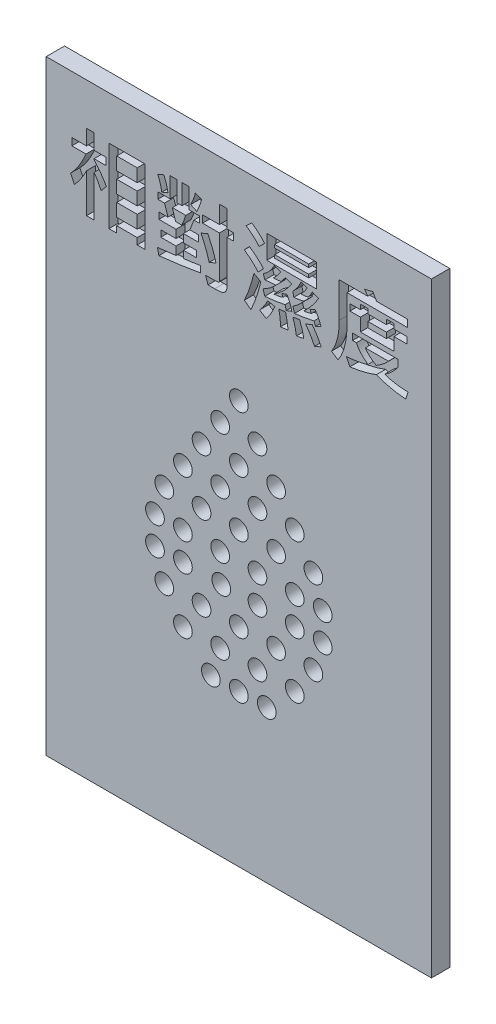
from build123d import *

# Parameters (mm, degrees)
SKETCH_4_W          = 105
SKETCH_4_H          = 165
EXTRUDE_2_DEPTH     = 5
SKETCH_11_R         = 2.55
CUT_EXTRUDE_6_DEPTH = 196.639975465
SKETCH_12_W         = 5.594131098
SKETCH_12_H         = 3.512195121
SKETCH_12_H_2       = 3.512195122
SKETCH_12_W_2       = 13.565167683
SKETCH_12_H_3       = 6.365853659
SKETCH_12_W_3       = 9.260670731
SKETCH_12_H_4       = 0.878048781
SKETCH_12_W_4       = 5.048780487
SKETCH_12_H_5       = 1.536585366
CUT_EXTRUDE_7_DEPTH = 2.5


with BuildPart() as part:
    # 草圖4 → 填料-伸長2 (new body)
    with BuildSketch(Plane.XY):
        with Locations((52.5, 82.5)):
            Rectangle(SKETCH_4_W, SKETCH_4_H)
    extrude(amount=EXTRUDE_2_DEPTH)

    # 草圖11 → 除料-伸長6 (cut, through all)
    with BuildSketch(Plane.XY.offset(5)):
        with Locations((52.5, 110)):
            Circle(SKETCH_11_R)
        with Locations((29.64, 71.9)):
            Circle(SKETCH_11_R)
        with Locations((29.64, 64.28)):
            Circle(SKETCH_11_R)
        with Locations((57.58, 64.28)):
            Circle(SKETCH_11_R)
        with Locations((75.36, 64.28)):
            Circle(SKETCH_11_R)
        with Locations((67.74, 64.28)):
            Circle(SKETCH_11_R)
        with Locations((62.66, 56.66)):
            Circle(SKETCH_11_R)
        with Locations((52.5, 56.66)):
            Circle(SKETCH_11_R)
        with Locations((32.18, 56.66)):
            Circle(SKETCH_11_R)
        with Locations((37.26, 49.04)):
            Circle(SKETCH_11_R)
        with Locations((52.5, 41.42)):
            Circle(SKETCH_11_R)
        with Locations((60.12, 41.42)):
            Circle(SKETCH_11_R)
        with Locations((42.34, 94.76)):
            Circle(SKETCH_11_R)
        with Locations((47.42, 102.38)):
            Circle(SKETCH_11_R)
        with Locations((57.58, 102.38)):
            Circle(SKETCH_11_R)
        with Locations((52.5, 94.76)):
            Circle(SKETCH_11_R)
        with Locations((62.66, 94.76)):
            Circle(SKETCH_11_R)
        with Locations((57.58, 87.14)):
            Circle(SKETCH_11_R)
        with Locations((67.74, 87.14)):
            Circle(SKETCH_11_R)
        with Locations((47.42, 87.14)):
            Circle(SKETCH_11_R)
        with Locations((37.26, 87.14)):
            Circle(SKETCH_11_R)
        with Locations((32.18, 79.52)):
            Circle(SKETCH_11_R)
        with Locations((42.34, 79.52)):
            Circle(SKETCH_11_R)
        with Locations((52.5, 79.52)):
            Circle(SKETCH_11_R)
        with Locations((62.66, 79.52)):
            Circle(SKETCH_11_R)
        with Locations((72.82, 79.52)):
            Circle(SKETCH_11_R)
        with Locations((75.36, 71.9)):
            Circle(SKETCH_11_R)
        with Locations((67.74, 71.9)):
            Circle(SKETCH_11_R)
        with Locations((57.58, 71.9)):
            Circle(SKETCH_11_R)
        with Locations((47.42, 71.9)):
            Circle(SKETCH_11_R)
        with Locations((37.26, 71.9)):
            Circle(SKETCH_11_R)
        with Locations((37.26, 64.28)):
            Circle(SKETCH_11_R)
        with Locations((47.72, 64.28)):
            Circle(SKETCH_11_R)
        with Locations((72.82, 56.66)):
            Circle(SKETCH_11_R)
        with Locations((42.34, 56.66)):
            Circle(SKETCH_11_R)
        with Locations((44.88, 41.42)):
            Circle(SKETCH_11_R)
        with Locations((47.42, 49.04)):
            Circle(SKETCH_11_R)
        with Locations((57.58, 49.04)):
            Circle(SKETCH_11_R)
        with Locations((67.74, 49.04)):
            Circle(SKETCH_11_R)
    extrude(amount=-CUT_EXTRUDE_6_DEPTH, mode=Mode.SUBTRACT)

    # 草圖12 → 除料-伸長7 (cut)
    # profile 1 of 20: a face of its own
    with BuildSketch(Plane.XY.offset(5)):
        with BuildLine():
            Line((16.410788695, 142.535623884), (14.963380159, 140.834404372))
            add(Edge.make_bspline(
                [(14.963380159, 140.834404372), (14.806352489, 141.161795807), (14.504596602, 141.790935206), (14.020781763, 142.67375544), (13.547360747, 143.469657872), (13.205702316, 143.951845162), (13.042648451, 144.181965347)],
                knots=[0, 0, 0, 0, 1.127094562, 2.16590759, 3.124693467, 4, 4, 4, 4], degree=3))
            Line((13.042648451, 144.181965347), (13.042648451, 132.931965347))
            Line((13.042648451, 132.931965347), (10.981291744, 132.931965347))
            Line((10.981291744, 132.931965347), (10.981291744, 143.537148274))
            add(Edge.make_bspline(
                [(10.981291744, 143.537148274), (10.876853719, 143.32010418), (10.667476337, 142.884974116), (10.318520089, 142.24832537), (9.948990335, 141.61890624), (9.55005242, 141.002309749), (9.128065376, 140.394790299), (8.681640689, 139.796972266), (8.208817935, 139.209282907), (7.874160368, 138.830093388), (7.705758207, 138.639282421)],
                knots=[0, 0, 0, 0, 0.977466001, 1.959624121, 2.945677103, 3.93937651, 4.939577317, 5.947477452, 6.967155486, 8, 8, 8, 8], degree=3))
            Line((7.705758207, 138.639282421), (6.663075281, 140.834404372))
            add(Edge.make_bspline(
                [(6.663075281, 140.834404372), (6.85761897, 141.036811539), (7.254688789, 141.449930963), (7.815144547, 142.125091692), (8.362617873, 142.85871992), (8.891794512, 143.652649208), (9.404112133, 144.50911243), (9.903369599, 145.423058038), (10.388174989, 146.397568034), (10.687796233, 147.074427862), (10.840666744, 147.419770225)],
                knots=[0, 0, 0, 0, 0.858778597, 1.752794251, 2.682626736, 3.658683669, 4.670785783, 5.735335257, 6.84453968, 8, 8, 8, 8], degree=3))
            Line((10.840666744, 147.419770225), (6.975194183, 147.419770225))
            Line((6.975194183, 147.419770225), (6.975194183, 149.395379982))
            Line((6.975194183, 149.395379982), (10.981291744, 149.395379982))
            Line((10.981291744, 149.395379982), (10.981291744, 153.566111689))
            Line((10.981291744, 153.566111689), (13.042648451, 153.566111689))
            Line((13.042648451, 153.566111689), (13.042648451, 149.395379982))
            Line((13.042648451, 149.395379982), (16.338761256, 149.395379982))
            Line((16.338761256, 149.395379982), (16.338761256, 147.419770225))
            Line((16.338761256, 147.419770225), (13.042648451, 147.419770225))
            Line((13.042648451, 147.419770225), (13.042648451, 147.255136079))
            add(Edge.make_bspline(
                [(13.042648451, 147.255136079), (13.221651043, 147.038443988), (13.572706075, 146.613473334), (14.077468292, 145.980070474), (14.545493628, 145.361429872), (14.988775701, 144.766822926), (15.386568139, 144.180947392), (15.762986865, 143.620386838), (16.10372503, 143.075277404), (16.310212303, 142.712383333), (16.410788695, 142.535623884)],
                knots=[0, 0, 0, 0, 1.161799404, 2.278489499, 3.347511781, 4.368347036, 5.343633091, 6.274248836, 7.159416347, 8, 8, 8, 8], degree=3))
        make_face()
    # profile 2 of 20: a face of its own
    with BuildSketch(Plane.XY.offset(5)):
        Polygon((26.885636256, 132.931965347), (24.803700281, 132.931965347), (24.803700281, 134.688062908), (19.209569183, 134.688062908), (19.209569183, 132.931965347), (17.093334427, 132.931965347), (17.093334427, 153.127087299), (26.885636256, 153.127087299), align=None)
        with Locations((22.006634732, 149.395379982)):
            Rectangle(SKETCH_12_W, SKETCH_12_H, mode=Mode.SUBTRACT)
        with Locations((22.006634732, 143.907575103)):
            Rectangle(SKETCH_12_W, SKETCH_12_H_2, mode=Mode.SUBTRACT)
        with Locations((22.006634732, 138.419770225)):
            Rectangle(SKETCH_12_W, SKETCH_12_H_2, mode=Mode.SUBTRACT)
    # profile 3 of 20: a face of its own
    with BuildSketch(Plane.XY.offset(5)):
        with BuildLine():
            Line((51.021688085, 146.980745835), (49.262160646, 146.980745835))
            Line((49.262160646, 146.980745835), (49.262160646, 135.264282421))
            add(Edge.make_bspline(
                [(49.262160646, 135.264282421), (49.258912173, 135.127714892), (49.252761117, 134.869121284), (49.17076933, 134.50698461), (49.046679573, 134.189279105), (48.861080184, 133.92694558), (48.6413622, 133.716864182), (48.409438362, 133.535439233), (48.154289326, 133.400089153), (47.926002637, 133.314236595), (47.723484815, 133.263890618), (47.543343589, 133.234308814), (47.336914081, 133.212712969), (47.105239097, 133.186128328), (46.846556236, 133.170428195), (46.560617571, 133.160995655), (46.24847217, 133.153949287), (46.031219368, 133.152324214), (45.918029549, 133.151477542)],
                knots=[0, 0, 0, 0, 1.432178217, 2.711860847, 3.880961985, 4.994154237, 6.05611614, 7.0677495, 8.078383575, 9.078176166, 9.623076621, 10.268952323, 10.994702176, 11.804044535, 12.719108509, 13.716950142, 14.81051937, 16, 16, 16, 16], degree=3))
            add(Edge.make_bspline(
                [(45.918029549, 133.151477542), (45.629919793, 133.151477542), (45.023974671, 133.151477542), (44.418029549, 133.151477542), (44.100194183, 133.151477542)],
                knots=[0, 0, 0, 0, 0.950943396, 2, 2, 2, 2], degree=3))
            Line((44.100194183, 133.151477542), (43.417648451, 135.127087299))
            add(Edge.make_bspline(
                [(43.417648451, 135.127087299), (43.743486866, 135.127087299), (44.37572772, 135.127087299), (45.007968573, 135.127087299), (45.314371012, 135.127087299)],
                knots=[0, 0, 0, 0, 1.03074141, 2, 2, 2, 2], degree=3))
            add(Edge.make_bspline(
                [(45.314371012, 135.127087299), (45.430997824, 135.126302619), (45.651699172, 135.124817712), (45.962592154, 135.134606186), (46.233797357, 135.137829949), (46.463438304, 135.153826385), (46.653447525, 135.165924473), (46.803608765, 135.182124656), (46.915085089, 135.201375881), (47.011120257, 135.229807358), (47.090547795, 135.290429098), (47.155984683, 135.381318494), (47.193752461, 135.495935613), (47.198341065, 135.579543927), (47.200803939, 135.624419616)],
                knots=[0, 0, 0, 0, 1.944896568, 3.680468406, 5.187292513, 6.467097316, 7.518585867, 8.362960417, 8.983756933, 9.405836548, 10.019861071, 10.607254988, 11.252462004, 12, 12, 12, 12], degree=3))
            Line((47.200803939, 135.624419616), (47.200803939, 146.980745835))
            Line((47.200803939, 146.980745835), (42.604767354, 146.980745835))
            Line((42.604767354, 146.980745835), (42.604767354, 148.956355591))
            Line((42.604767354, 148.956355591), (47.200803939, 148.956355591))
            Line((47.200803939, 148.956355591), (47.200803939, 153.785623884))
            Line((47.200803939, 153.785623884), (49.262160646, 153.785623884))
            Line((49.262160646, 153.785623884), (49.262160646, 148.956355591))
            Line((49.262160646, 148.956355591), (51.021688085, 148.956355591))
            Line((51.021688085, 148.956355591), (51.021688085, 146.980745835))
        make_face()
    # profile 4 of 20: a face of its own
    with BuildSketch(Plane.XY.offset(5)):
        with BuildLine():
            add(Edge.make_bspline(
                [(42.08342589, 134.962453152), (41.647973252, 134.885034428), (40.766352067, 134.728291809), (39.426448786, 134.505801969), (38.053345044, 134.292638552), (36.647769397, 134.091969994), (35.209799414, 133.89506832), (33.738249086, 133.710277209), (32.23341305, 133.536008388), (31.218788267, 133.426352996), (30.706520402, 133.370989738)],
                knots=[0, 0, 0, 0, 0.923789585, 1.8703124, 2.83691948, 3.826085748, 4.835874672, 5.868411536, 6.923794993, 8, 8, 8, 8], degree=3))
            Line((30.706520402, 133.370989738), (30.322374061, 135.127087299))
            add(Edge.make_bspline(
                [(30.322374061, 135.127087299), (30.653989168, 135.164299168), (31.283100267, 135.234894264), (32.174402147, 135.342927811), (32.962085794, 135.435913118), (33.646348381, 135.512282804), (34.224335516, 135.5863452), (34.699057725, 135.643703646), (35.069600748, 135.690989563), (35.282003918, 135.721408265), (35.371154549, 135.734175713)],
                knots=[0, 0, 0, 0, 1.574879537, 2.987723342, 4.237278493, 5.318190049, 6.237092805, 6.987341425, 7.574963259, 8, 8, 8, 8], degree=3))
            Line((35.371154549, 135.734175713), (35.371154549, 137.980745835))
            Line((35.371154549, 137.980745835), (31.227861866, 137.980745835))
            Line((31.227861866, 137.980745835), (31.227861866, 139.736843396))
            Line((31.227861866, 139.736843396), (35.371154549, 139.736843396))
            Line((35.371154549, 139.736843396), (35.371154549, 141.931965347))
            Line((35.371154549, 141.931965347), (30.706520402, 141.931965347))
            Line((30.706520402, 141.931965347), (30.706520402, 143.688062908))
            Line((30.706520402, 143.688062908), (33.17260272, 143.688062908))
            add(Edge.make_bspline(
                [(33.17260272, 143.688062908), (33.113554224, 143.905740214), (32.990788502, 144.358305711), (32.769451007, 145.050628688), (32.515847806, 145.785845465), (32.32255072, 146.283963473), (32.2225265, 146.541721445)],
                knots=[0, 0, 0, 0, 0.899262793, 1.869626752, 2.897609239, 4, 4, 4, 4], degree=3))
            Line((32.2225265, 146.541721445), (30.438989915, 146.541721445))
            Line((30.438989915, 146.541721445), (30.438989915, 148.297819006))
            Line((30.438989915, 148.297819006), (33.762541744, 148.297819006))
            Line((33.762541744, 148.297819006), (33.762541744, 153.785623884))
            Line((33.762541744, 153.785623884), (35.659264305, 153.785623884))
            Line((35.659264305, 153.785623884), (35.659264305, 148.297819006))
            Line((35.659264305, 148.297819006), (37.014066134, 148.297819006))
            Line((37.014066134, 148.297819006), (37.014066134, 153.785623884))
            Line((37.014066134, 153.785623884), (38.900499061, 153.785623884))
            Line((38.900499061, 153.785623884), (38.900499061, 148.297819006))
            Line((38.900499061, 148.297819006), (41.795316134, 148.297819006))
            Line((41.795316134, 148.297819006), (41.795316134, 146.541721445))
            Line((41.795316134, 146.541721445), (40.25530089, 146.541721445))
            add(Edge.make_bspline(
                [(40.25530089, 146.541721445), (40.188029239, 146.337750796), (40.045517464, 145.905648732), (39.790337889, 145.228014406), (39.497471657, 144.479821541), (39.281080109, 143.959760894), (39.168029549, 143.688062908)],
                knots=[0, 0, 0, 0, 0.843659117, 1.787251491, 2.843982302, 4, 4, 4, 4], degree=3))
            Line((39.168029549, 143.688062908), (41.565514305, 143.688062908))
            Line((41.565514305, 143.688062908), (41.565514305, 141.931965347))
            Line((41.565514305, 141.931965347), (37.384492963, 141.931965347))
            Line((37.384492963, 141.931965347), (37.384492963, 139.736843396))
            Line((37.384492963, 139.736843396), (41.020163695, 139.736843396))
            Line((41.020163695, 139.736843396), (41.020163695, 137.980745835))
            Line((41.020163695, 137.980745835), (37.384492963, 137.980745835))
            Line((37.384492963, 137.980745835), (37.384492963, 136.042864738))
            add(Edge.make_bspline(
                [(37.384492963, 136.042864738), (37.733359819, 136.081529122), (38.458294129, 136.161872492), (39.582387892, 136.31403012), (40.785282916, 136.499629046), (41.611489542, 136.643918364), (42.038837476, 136.718550713)],
                knots=[0, 0, 0, 0, 0.89536347, 1.860537016, 2.893382048, 4, 4, 4, 4], degree=3))
            Line((42.038837476, 136.718550713), (42.08342589, 134.962453152))
        make_face()
        with BuildLine():
            Line((38.032739915, 146.541721445), (34.376489915, 146.541721445))
            add(Edge.make_bspline(
                [(34.376489915, 146.541721445), (34.426742957, 146.383930439), (34.523627414, 146.079720079), (34.664688711, 145.639692526), (34.79520857, 145.233099134), (34.911777145, 144.859216928), (35.015061002, 144.519759202), (35.104189303, 144.212997167), (35.182731606, 143.939650551), (35.231694915, 143.768099754), (35.254538695, 143.688062908)],
                knots=[0, 0, 0, 0, 1.331052196, 2.566178376, 3.714131703, 4.763387016, 5.714001717, 6.566053143, 7.33099359, 8, 8, 8, 8], degree=3))
            Line((35.254538695, 143.688062908), (36.935178939, 143.688062908))
            add(Edge.make_bspline(
                [(36.935178939, 143.688062908), (37.054390289, 143.954963629), (37.282355434, 144.465351791), (37.58657725, 145.207558765), (37.835208345, 145.891873494), (37.969317897, 146.333072932), (38.032739915, 146.541721445)],
                knots=[0, 0, 0, 0, 1.146244092, 2.191936434, 3.144945024, 4, 4, 4, 4], degree=3))
        make_face(mode=Mode.SUBTRACT)
    # profile 5 of 20: a face of its own
    with BuildSketch(Plane.XY.offset(5)):
        with BuildLine():
            add(Edge.make_bspline(
                [(42.340666744, 152.489129982), (42.313432661, 152.360753657), (42.257412204, 152.096683797), (42.144688234, 151.696075385), (42.016126741, 151.277571924), (41.859213307, 150.843672201), (41.682672142, 150.393846483), (41.48043442, 149.92863599), (41.263805288, 149.445274245), (41.102500304, 149.121581502), (41.020163695, 148.956355591)],
                knots=[0, 0, 0, 0, 0.832525581, 1.712503563, 2.639520533, 3.61016422, 4.6394157, 5.705367216, 6.828726321, 8, 8, 8, 8], degree=3))
            Line((41.020163695, 148.956355591), (39.397831378, 149.779526323))
            add(Edge.make_bspline(
                [(39.397831378, 149.779526323), (39.478659496, 149.948362182), (39.635731822, 150.276458908), (39.850914072, 150.759491391), (40.044015328, 151.216497924), (40.213160897, 151.646958595), (40.35286651, 152.054167456), (40.475113018, 152.432629089), (40.568008109, 152.788068294), (40.61627938, 153.017142751), (40.639447232, 153.127087299)],
                knots=[0, 0, 0, 0, 1.254899727, 2.438631792, 3.544750468, 4.580993626, 5.53849875, 6.430601248, 7.246765271, 8, 8, 8, 8], degree=3))
            Line((40.639447232, 153.127087299), (42.340666744, 152.489129982))
        make_face()
    # profile 6 of 20: a face of its own
    with BuildSketch(Plane.XY.offset(5)):
        with BuildLine():
            Line((33.193181988, 149.439968396), (31.481672842, 148.736843396))
            add(Edge.make_bspline(
                [(31.481672842, 148.736843396), (31.429487122, 149.05342691), (31.325046744, 149.687012146), (31.077868007, 150.621686959), (30.777625409, 151.546248901), (30.522426462, 152.144445769), (30.3944015, 152.444541567)],
                knots=[0, 0, 0, 0, 0.992952492, 1.987216678, 2.990252459, 4, 4, 4, 4], degree=3))
            Line((30.3944015, 152.444541567), (32.0819015, 153.127087299))
            add(Edge.make_bspline(
                [(32.0819015, 153.127087299), (32.203523517, 152.832415609), (32.447399925, 152.241540081), (32.744179524, 151.326504257), (33.003087444, 150.393636863), (33.129645339, 149.758719778), (33.193181988, 149.439968396)],
                knots=[0, 0, 0, 0, 0.9910496, 1.987252172, 2.989527663, 4, 4, 4, 4], degree=3))
        make_face()
    # profile 7 of 20: a face of its own
    with BuildSketch(Plane.XY.offset(5)):
        with BuildLine():
            Line((46.274736866, 139.404145225), (44.412313085, 138.639282421))
            add(Edge.make_bspline(
                [(44.412313085, 138.639282421), (44.354306775, 138.848935214), (44.234875386, 139.280597293), (44.023081938, 139.935601587), (43.790834935, 140.621744075), (43.524489969, 141.332533038), (43.238259406, 142.075160484), (42.917364489, 142.842384989), (42.57169398, 143.638565244), (42.325602695, 144.175526768), (42.200041744, 144.449495835)],
                knots=[0, 0, 0, 0, 0.838675114, 1.726779961, 2.653856062, 3.631617982, 4.65330324, 5.722511815, 6.837977613, 8, 8, 8, 8], degree=3))
            Line((42.200041744, 144.449495835), (44.076185037, 145.224648274))
            add(Edge.make_bspline(
                [(44.076185037, 145.224648274), (44.208825037, 144.940496382), (44.467709026, 144.385894636), (44.826647341, 143.566578762), (45.15418635, 142.783931217), (45.445247623, 142.036947841), (45.703893074, 141.327165559), (45.925498122, 140.653900342), (46.122653056, 140.019932747), (46.225193549, 139.604746172), (46.274736866, 139.404145225)],
                knots=[0, 0, 0, 0, 1.207618848, 2.357005324, 3.444539343, 4.474768872, 5.444162872, 6.35336321, 7.204413343, 8, 8, 8, 8], degree=3))
        make_face()
    # profile 8 of 20: a face of its own
    with BuildSketch(Plane.XY.offset(5)):
        with BuildLine():
            Line((59.551794793, 150.657575103), (58.035788695, 149.175867786))
            add(Edge.make_bspline(
                [(58.035788695, 149.175867786), (57.935259314, 149.300379895), (57.726925976, 149.55841414), (57.380436907, 149.936724032), (56.993400044, 150.322018227), (56.569700199, 150.715270168), (56.104661961, 151.113914979), (55.600079255, 151.517149656), (55.057915686, 151.930381815), (54.677633491, 152.19988146), (54.482435037, 152.338215347)],
                knots=[0, 0, 0, 0, 0.804478505, 1.667171227, 2.577683234, 3.549855586, 4.573035716, 5.656634714, 6.797153041, 8, 8, 8, 8], degree=3))
            Line((54.482435037, 152.338215347), (56.022450281, 153.785623884))
            add(Edge.make_bspline(
                [(56.022450281, 153.785623884), (56.208534096, 153.654198142), (56.573191178, 153.396651146), (57.093781498, 152.99834618), (57.581656547, 152.601840203), (58.042476921, 152.2133471), (58.467315902, 151.822265517), (58.858746323, 151.433534949), (59.221777306, 151.05022816), (59.443262733, 150.786705973), (59.551794793, 150.657575103)],
                knots=[0, 0, 0, 0, 1.155815516, 2.264981036, 3.324954452, 4.345512296, 5.322610562, 6.25373632, 7.144297674, 8, 8, 8, 8], degree=3))
        make_face()
    # profile 9 of 20: a face of its own
    with BuildSketch(Plane.XY.offset(5)):
        with Locations((66.903738391, 150.163672665)):
            Rectangle(SKETCH_12_W_2, SKETCH_12_H_3)
        with Locations((66.915742964, 151.370989737)):
            Rectangle(SKETCH_12_W_3, SKETCH_12_H_4, mode=Mode.SUBTRACT)
        with Locations((66.915742964, 148.956355592)):
            Rectangle(SKETCH_12_W_3, SKETCH_12_H_4, mode=Mode.SUBTRACT)
    # profile 10 of 20: a face of its own
    with BuildSketch(Plane.XY.offset(5)):
        with BuildLine():
            Line((59.229386256, 144.51123364), (57.757968573, 143.029526323))
            add(Edge.make_bspline(
                [(57.757968573, 143.029526323), (57.628668871, 143.182474208), (57.36878016, 143.489895093), (56.957359488, 143.937851376), (56.51524597, 144.367487254), (56.058265437, 144.795207653), (55.57133428, 145.204489578), (55.068810766, 145.61246554), (54.536444489, 146.001458279), (54.169874525, 146.25120231), (53.98510272, 146.377087299)],
                knots=[0, 0, 0, 0, 0.949510267, 1.908488544, 2.88206213, 3.87167945, 4.875285666, 5.897054234, 6.939997475, 8, 8, 8, 8], degree=3))
            Line((53.98510272, 146.377087299), (55.384492963, 147.858794616))
            add(Edge.make_bspline(
                [(55.384492963, 147.858794616), (55.57852548, 147.728503513), (55.961470864, 147.471359108), (56.513552949, 147.070656467), (57.034232982, 146.660844585), (57.532426754, 146.250211375), (57.9958457, 145.824168142), (58.436412755, 145.395423975), (58.84966384, 144.96150336), (59.103928538, 144.65999971), (59.229386256, 144.51123364)],
                knots=[0, 0, 0, 0, 1.096221322, 2.163518267, 3.198740064, 4.203955165, 5.190923605, 6.150365986, 7.087365001, 8, 8, 8, 8], degree=3))
        make_face()
    # profile 11 of 20: a face of its own
    with BuildSketch(Plane.XY.offset(5)):
        with BuildLine():
            Line((66.950041744, 138.351172664), (65.434035646, 137.76123364))
            add(Edge.make_bspline(
                [(65.434035646, 137.76123364), (65.383396497, 137.956957158), (65.276818361, 138.368888398), (65.159489335, 138.777889868), (65.097907598, 138.99255986)],
                knots=[0, 0, 0, 0, 0.950272763, 2, 2, 2, 2], degree=3))
            add(Edge.make_bspline(
                [(65.097907598, 138.99255986), (64.648000743, 138.90157002), (63.743935983, 138.718730601), (62.37236318, 138.497305283), (60.981285791, 138.320429349), (60.046027431, 138.240463015), (59.575803939, 138.20025803)],
                knots=[0, 0, 0, 0, 0.986583467, 1.982488901, 2.98564808, 4, 4, 4, 4], degree=3))
            Line((59.575803939, 138.20025803), (59.102480768, 139.74713303))
            add(Edge.make_bspline(
                [(59.102480768, 139.74713303), (59.251820543, 139.820053591), (59.554352673, 139.967775876), (60.002008902, 140.219022586), (60.44561641, 140.504428181), (60.889654494, 140.816480881), (61.329135085, 141.161365186), (61.766793319, 141.534965547), (62.205620966, 141.937109094), (62.487907173, 142.224479533), (62.631825281, 142.370989738)],
                knots=[0, 0, 0, 0, 0.901794344, 1.826852659, 2.783820274, 3.7633116, 4.771123465, 5.814241954, 6.885633964, 8, 8, 8, 8], degree=3))
            add(Edge.make_bspline(
                [(62.631825281, 142.370989738), (62.546113003, 142.359287423), (62.363448206, 142.334348162), (62.070690452, 142.300348514), (61.743625185, 142.266717735), (61.381246453, 142.231746946), (60.985390082, 142.199447167), (60.554787122, 142.158921498), (60.089198528, 142.126592966), (59.766734102, 142.10456975), (59.599813085, 142.093169616)],
                knots=[0, 0, 0, 0, 0.681757328, 1.452919794, 2.32259444, 3.27296304, 4.322041208, 5.452688619, 6.681405536, 8, 8, 8, 8], degree=3))
            Line((59.599813085, 142.093169616), (59.171078329, 143.393093396))
            add(Edge.make_bspline(
                [(59.171078329, 143.393093396), (59.317022525, 143.48178149), (59.61219563, 143.66115375), (60.024560227, 143.984737421), (60.426407822, 144.341553039), (60.805662864, 144.746357022), (61.174125035, 145.187435593), (61.519110462, 145.675217299), (61.85410052, 146.199068897), (62.055626697, 146.571244718), (62.15850211, 146.76123364)],
                knots=[0, 0, 0, 0, 0.897720749, 1.815646182, 2.752723531, 3.72277066, 4.730858853, 5.774079112, 6.863708264, 8, 8, 8, 8], degree=3))
            Line((62.15850211, 146.76123364), (63.938608817, 146.150715347))
            add(Edge.make_bspline(
                [(63.938608817, 146.150715347), (63.794792055, 145.927459871), (63.506712214, 145.480256076), (63.004537738, 144.851606205), (62.460262146, 144.246414127), (62.058604215, 143.874859838), (61.856672842, 143.688062908)],
                knots=[0, 0, 0, 0, 0.984336612, 1.971727984, 2.980297103, 4, 4, 4, 4], degree=3))
            add(Edge.make_bspline(
                [(61.856672842, 143.688062908), (62.004254376, 143.692109187), (62.322920645, 143.700846136), (62.836795247, 143.752827657), (63.422605022, 143.83513105), (63.835989546, 143.911605771), (64.055224671, 143.952163518)],
                knots=[0, 0, 0, 0, 0.798846567, 1.724913995, 2.793426617, 4, 4, 4, 4], degree=3))
            add(Edge.make_bspline(
                [(64.055224671, 143.952163518), (64.128578754, 144.040045538), (64.269099066, 144.208396205), (64.467146875, 144.45151103), (64.646118245, 144.672585739), (64.80723836, 144.868622808), (64.94366443, 145.045978147), (65.065108468, 145.196025817), (65.164987259, 145.326134583), (65.222729725, 145.407426502), (65.248822232, 145.444160469)],
                knots=[0, 0, 0, 0, 1.437631374, 2.753989958, 3.938012056, 5.0099012, 5.940541151, 6.747808894, 7.434163343, 8, 8, 8, 8], degree=3))
            Line((65.248822232, 145.444160469), (66.902023451, 144.737605591))
            add(Edge.make_bspline(
                [(66.902023451, 144.737605591), (66.746816585, 144.508245735), (66.43584807, 144.04870618), (65.921611314, 143.390923768), (65.372883549, 142.753771933), (64.781296474, 142.145492704), (64.157553861, 141.555442197), (63.487983531, 140.997259323), (62.784850335, 140.457755706), (62.290614719, 140.124213612), (62.041886256, 139.956355591)],
                knots=[0, 0, 0, 0, 0.96777581, 1.939010914, 2.916474575, 3.90565638, 4.903654516, 5.916267968, 6.951343349, 8, 8, 8, 8], degree=3))
            add(Edge.make_bspline(
                [(62.041886256, 139.956355591), (62.277764553, 139.978633832), (62.730583706, 140.021401711), (63.377615592, 140.128863075), (63.966511497, 140.262194526), (64.332666329, 140.382412295), (64.507968573, 140.439968396)],
                knots=[0, 0, 0, 0, 1.128026246, 2.165489131, 3.121699775, 4, 4, 4, 4], degree=3))
            add(Edge.make_bspline(
                [(64.507968573, 140.439968396), (64.464702166, 140.566195961), (64.377899022, 140.81943976), (64.24752179, 141.053258809), (64.182130159, 141.170532421)],
                knots=[0, 0, 0, 0, 0.996885732, 2, 2, 2, 2], degree=3))
            Line((64.182130159, 141.170532421), (65.653547842, 141.712453152))
            add(Edge.make_bspline(
                [(65.653547842, 141.712453152), (65.789735661, 141.431187845), (66.058354792, 140.876415453), (66.414464749, 140.034922852), (66.709167107, 139.193924293), (66.870401007, 138.629812882), (66.950041744, 138.351172664)],
                knots=[0, 0, 0, 0, 1.039023468, 2.049387252, 3.036503873, 4, 4, 4, 4], degree=3))
        make_face()
    # profile 12 of 20: a face of its own
    with BuildSketch(Plane.XY.offset(5)):
        with BuildLine():
            Line((74.890209427, 138.731889128), (73.374203329, 137.980745835))
            add(Edge.make_bspline(
                [(73.374203329, 137.980745835), (73.346286536, 138.088396906), (73.292583527, 138.295483237), (73.204015922, 138.592785627), (73.106662452, 138.862542277), (73.030004085, 139.029597003), (72.993486866, 139.109175713)],
                knots=[0, 0, 0, 0, 1.11858568, 2.151802126, 3.1195867, 4, 4, 4, 4], degree=3))
            add(Edge.make_bspline(
                [(72.993486866, 139.109175713), (72.508128873, 139.003618861), (71.56829067, 138.799220532), (70.194556471, 138.54584321), (68.904590866, 138.343217602), (68.069674706, 138.246781622), (67.666886256, 138.20025803)],
                knots=[0, 0, 0, 0, 1.102408141, 2.134682648, 3.100115291, 4, 4, 4, 4], degree=3))
            Line((67.666886256, 138.20025803), (67.262160646, 139.736843396))
            add(Edge.make_bspline(
                [(67.262160646, 139.736843396), (67.542661386, 139.921429089), (68.100241597, 140.288349081), (68.865881023, 140.928916503), (69.588561942, 141.61058374), (70.013084875, 142.117338882), (70.225575281, 142.370989738)],
                knots=[0, 0, 0, 0, 1.010998725, 2.009666295, 3.003759792, 4, 4, 4, 4], degree=3))
            add(Edge.make_bspline(
                [(70.225575281, 142.370989738), (70.032849094, 142.321920329), (69.628193115, 142.218892142), (68.978348397, 142.101918767), (68.26084719, 142.002820705), (67.757435783, 141.95622175), (67.495392354, 141.931965347)],
                knots=[0, 0, 0, 0, 0.861672777, 1.809204284, 2.859613404, 4, 4, 4, 4], degree=3))
            Line((67.495392354, 141.931965347), (67.193563085, 143.22845925))
            add(Edge.make_bspline(
                [(67.193563085, 143.22845925), (67.308198232, 143.336776003), (67.538751346, 143.554621625), (67.860370048, 143.909983154), (68.16664093, 144.287499408), (68.453905582, 144.691035769), (68.731118463, 145.115225503), (68.980935238, 145.570018566), (69.22531112, 146.043550245), (69.367759454, 146.373887121), (69.440133207, 146.541721445)],
                knots=[0, 0, 0, 0, 0.93785244, 1.886199894, 2.848490824, 3.828026433, 4.83160774, 5.860763834, 6.913117846, 8, 8, 8, 8], degree=3))
            Line((69.440133207, 146.541721445), (71.107053939, 145.951782421))
            add(Edge.make_bspline(
                [(71.107053939, 145.951782421), (71.015109435, 145.7743683), (70.82028319, 145.398435805), (70.422360957, 144.85334356), (69.953072755, 144.266500665), (69.585393447, 143.887364162), (69.392114915, 143.688062908)],
                knots=[0, 0, 0, 0, 0.839679711, 1.779243315, 2.832611508, 4, 4, 4, 4], degree=3))
            add(Edge.make_bspline(
                [(69.392114915, 143.688062908), (69.541971253, 143.690912435), (69.853631019, 143.696838663), (70.336604703, 143.740837678), (70.851694058, 143.808732981), (71.203354984, 143.873924684), (71.384874061, 143.907575103)],
                knots=[0, 0, 0, 0, 0.895616059, 1.862633878, 2.896742016, 4, 4, 4, 4], degree=3))
            add(Edge.make_bspline(
                [(71.384874061, 143.907575103), (71.487894756, 144.042702873), (71.695712336, 144.315288165), (71.986545401, 144.744510267), (72.261795766, 145.194689923), (72.431176962, 145.50628271), (72.516733817, 145.663672664)],
                knots=[0, 0, 0, 0, 0.97454427, 1.965890756, 2.97254245, 4, 4, 4, 4], degree=3))
            Line((72.516733817, 145.663672664), (74.255681988, 145.029145225))
            add(Edge.make_bspline(
                [(74.255681988, 145.029145225), (74.100651342, 144.780022609), (73.794655779, 144.288310699), (73.313530971, 143.577521502), (72.819963989, 142.900853499), (72.311771113, 142.260128552), (71.794499209, 141.650634433), (71.26060859, 141.07913613), (70.7222258, 140.533624969), (70.344056079, 140.19789605), (70.15697772, 140.031812908)],
                knots=[0, 0, 0, 0, 1.08526374, 2.142066085, 3.174004248, 4.182523267, 5.166421176, 6.12996899, 7.074906544, 8, 8, 8, 8], degree=3))
            add(Edge.make_bspline(
                [(70.15697772, 140.031812908), (70.363112893, 140.063076929), (70.758385597, 140.123026979), (71.322621614, 140.239499868), (71.837734258, 140.356585964), (72.158333885, 140.459553041), (72.310941134, 140.508565957)],
                knots=[0, 0, 0, 0, 1.132429604, 2.171480521, 3.129614306, 4, 4, 4, 4], degree=3))
            add(Edge.make_bspline(
                [(72.310941134, 140.508565957), (72.252551484, 140.626447932), (72.125671057, 140.882604894), (71.96755716, 141.120826329), (71.882206378, 141.249419616)],
                knots=[0, 0, 0, 0, 0.92038861, 2, 2, 2, 2], degree=3))
            Line((71.882206378, 141.249419616), (73.305605768, 141.931965347))
            add(Edge.make_bspline(
                [(73.305605768, 141.931965347), (73.456613778, 141.700847888), (73.76605753, 141.22724484), (74.174284892, 140.456812026), (74.557563336, 139.622546642), (74.777335339, 139.034108685), (74.890209427, 138.731889128)],
                knots=[0, 0, 0, 0, 0.924910989, 1.89531619, 2.919042181, 4, 4, 4, 4], degree=3))
        make_face()
    # profile 13 of 20: a face of its own
    with BuildSketch(Plane.XY.offset(5)):
        with BuildLine():
            add(Edge.make_bspline(
                [(58.488532598, 141.084785469), (58.403185607, 140.729980424), (58.233387275, 140.024093738), (57.95312732, 138.979286611), (57.646606321, 137.956380314), (57.320879749, 136.954508552), (56.975206929, 135.972486689), (56.604387549, 135.01182019), (56.210769295, 134.071671963), (55.929242538, 133.457132982), (55.789218573, 133.151477542)],
                knots=[0, 0, 0, 0, 1.043198986, 2.075450406, 3.091934491, 4.095536977, 5.086866515, 6.067726075, 7.038938042, 8, 8, 8, 8], degree=3))
            Line((55.789218573, 133.151477542), (54.009111866, 134.495989738))
            add(Edge.make_bspline(
                [(54.009111866, 134.495989738), (54.136534544, 134.76963188), (54.395461702, 135.325681894), (54.758992633, 136.187873616), (55.103003425, 137.089422983), (55.43706623, 138.027907503), (55.755153945, 139.003435708), (56.056834203, 140.018226997), (56.345338601, 141.070248747), (56.522492922, 141.787507121), (56.612389305, 142.151477542)],
                knots=[0, 0, 0, 0, 0.894278456, 1.817203829, 2.77150305, 3.752879626, 4.768364397, 5.811136798, 6.889268508, 8, 8, 8, 8], degree=3))
            Line((56.612389305, 142.151477542), (58.488532598, 141.084785469))
        make_face()
    # profile 14 of 20: a face of its own
    with BuildSketch(Plane.XY.offset(5)):
        with BuildLine():
            Line((74.93822772, 133.950639128), (73.120392354, 133.151477542))
            add(Edge.make_bspline(
                [(73.120392354, 133.151477542), (73.05151751, 133.308495454), (72.910748566, 133.629414447), (72.678349353, 134.113875543), (72.411686961, 134.607347187), (72.122284176, 135.114249903), (71.800245174, 135.62944313), (71.455370617, 136.158556436), (71.076209971, 136.69556916), (70.812596193, 137.056198386), (70.678319183, 137.239892177)],
                knots=[0, 0, 0, 0, 0.861968286, 1.76172255, 2.700294031, 3.681272211, 4.695694105, 5.754229235, 6.856071235, 8, 8, 8, 8], degree=3))
            Line((70.678319183, 137.239892177), (72.516733817, 137.980745835))
            add(Edge.make_bspline(
                [(72.516733817, 137.980745835), (72.75011181, 137.66079665), (73.215305743, 137.023039774), (73.846756054, 136.026220261), (74.429110516, 135.005947739), (74.768447522, 134.302563013), (74.93822772, 133.950639128)],
                knots=[0, 0, 0, 0, 1.008758134, 2.010764413, 3.00472744, 4, 4, 4, 4], degree=3))
        make_face()
    # profile 15 of 20: a face of its own
    with BuildSketch(Plane.XY.offset(5)):
        with BuildLine():
            add(Edge.make_bspline(
                [(62.309416744, 137.112986689), (62.227341365, 136.920293233), (62.064896164, 136.538910567), (61.800625549, 135.985749153), (61.526338838, 135.453484225), (61.233908249, 134.948345545), (60.933891354, 134.461487869), (60.611946928, 134.003799311), (60.286668976, 133.562436691), (60.051911249, 133.287363474), (59.935941134, 133.151477542)],
                knots=[0, 0, 0, 0, 1.083651596, 2.144784487, 3.171435029, 4.181122075, 5.164397398, 6.129349215, 7.075900129, 8, 8, 8, 8], degree=3))
            Line((59.935941134, 133.151477542), (58.152404549, 134.276477542))
            add(Edge.make_bspline(
                [(58.152404549, 134.276477542), (58.370442205, 134.519938103), (58.807365314, 135.007805873), (59.387489558, 135.804594992), (59.914511204, 136.647606717), (60.213746519, 137.241946322), (60.36467589, 137.541721445)],
                knots=[0, 0, 0, 0, 0.990079047, 1.984007825, 2.983166701, 4, 4, 4, 4], degree=3))
            Line((60.36467589, 137.541721445), (62.309416744, 137.112986689))
        make_face()
    # profile 16 of 20: a face of its own
    with BuildSketch(Plane.XY.offset(5)):
        with BuildLine():
            Line((70.180986866, 133.545913518), (68.18822772, 133.151477542))
            add(Edge.make_bspline(
                [(68.18822772, 133.151477542), (68.136369557, 133.499790163), (68.03400312, 134.187348693), (67.810268837, 135.192857169), (67.54651145, 136.164047968), (67.32652918, 136.789487664), (67.217572232, 137.099267177)],
                knots=[0, 0, 0, 0, 1.037165939, 2.047334048, 3.032846955, 4, 4, 4, 4], degree=3))
            Line((67.217572232, 137.099267177), (69.090285646, 137.449114738))
            add(Edge.make_bspline(
                [(69.090285646, 137.449114738), (69.218690936, 137.106276916), (69.468771572, 136.438569993), (69.771264506, 135.441303963), (70.018738087, 134.484605269), (70.127879442, 133.853166993), (70.180986866, 133.545913518)],
                knots=[0, 0, 0, 0, 1.081742834, 2.106789659, 3.07877701, 4, 4, 4, 4], degree=3))
        make_face()
    # profile 17 of 20: a face of its own
    with BuildSketch(Plane.XY.offset(5)):
        with BuildLine():
            Line((65.907358817, 133.370989738), (63.870011256, 133.151477542))
            add(Edge.make_bspline(
                [(63.870011256, 133.151477542), (63.858893913, 133.49354551), (63.836879992, 134.170888738), (63.738767724, 135.172802157), (63.591579854, 136.150581664), (63.445307269, 136.786798188), (63.372678939, 137.102697055)],
                knots=[0, 0, 0, 0, 1.028962611, 2.037492324, 3.025561381, 4, 4, 4, 4], degree=3))
            Line((63.372678939, 137.102697055), (65.248822232, 137.32220925))
            add(Edge.make_bspline(
                [(65.248822232, 137.32220925), (65.330854761, 136.985624749), (65.493075872, 136.320021576), (65.67862574, 135.322599261), (65.823978233, 134.342311947), (65.879749157, 133.692621885), (65.907358817, 133.370989738)],
                knots=[0, 0, 0, 0, 1.036350308, 2.049405278, 3.034348827, 4, 4, 4, 4], degree=3))
        make_face()
    # profile 18 of 20: a face of its own
    with BuildSketch(Plane.XY.offset(5)):
        with BuildLine():
            Line((98.504919793, 150.273428762), (81.98662711, 150.273428762))
            Line((81.98662711, 150.273428762), (81.98662711, 142.604221445))
            add(Edge.make_bspline(
                [(81.98662711, 142.604221445), (81.979594468, 142.136391054), (81.965817226, 141.219891558), (81.851791616, 139.877029064), (81.660354468, 138.597301296), (81.394380141, 137.38076995), (81.051137138, 136.227071357), (80.633012377, 135.136548174), (80.137833459, 134.107332327), (79.741230986, 133.468351275), (79.544553939, 133.151477542)],
                knots=[0, 0, 0, 0, 1.13379834, 2.221158835, 3.263630851, 4.268138338, 5.236941435, 6.178197068, 7.096559291, 8, 8, 8, 8], degree=3))
            Line((79.544553939, 133.151477542), (77.761017354, 134.345075103))
            add(Edge.make_bspline(
                [(77.761017354, 134.345075103), (77.930825707, 134.617684425), (78.274581327, 135.169547654), (78.70074366, 136.063750801), (79.059028302, 137.017422949), (79.360243371, 138.029831376), (79.586237747, 139.105104034), (79.751440858, 140.241332343), (79.846314285, 141.438728458), (79.859977908, 142.257638598), (79.866962476, 142.676248884)],
                knots=[0, 0, 0, 0, 0.883888601, 1.789321126, 2.72197617, 3.687277845, 4.695045742, 5.744945383, 6.847261732, 8, 8, 8, 8], degree=3))
            Line((79.866962476, 142.676248884), (79.866962476, 152.249038518))
            Line((79.866962476, 152.249038518), (87.64592589, 152.249038518))
            add(Edge.make_bspline(
                [(87.64592589, 152.249038518), (87.497790184, 152.47824046), (87.217727344, 152.911565745), (86.895606875, 153.314545287), (86.743867963, 153.504373884)],
                knots=[0, 0, 0, 0, 1.057874767, 2, 2, 2, 2], degree=3))
            Line((86.743867963, 153.504373884), (89.048746012, 154.005136079))
            add(Edge.make_bspline(
                [(89.048746012, 154.005136079), (89.20951922, 153.726576297), (89.545816923, 153.143898272), (89.872765669, 152.555922056), (90.043410646, 152.249038518)],
                knots=[0, 0, 0, 0, 0.956136221, 2, 2, 2, 2], degree=3))
            Line((90.043410646, 152.249038518), (98.504919793, 152.249038518))
            Line((98.504919793, 152.249038518), (98.504919793, 150.273428762))
        make_face()
    # profile 19 of 20: a face of its own
    with BuildSketch(Plane.XY.offset(5)):
        Polygon((98.275117963, 146.32220925), (94.790361866, 146.32220925), (94.790361866, 142.810014128), (85.632587476, 142.810014128), (85.632587476, 146.32220925), (82.785788695, 146.32220925), (82.785788695, 148.078306811), (85.632587476, 148.078306811), (85.632587476, 149.395379982), (87.669935037, 149.395379982), (87.669935037, 148.078306811), (92.718715524, 148.078306811), (92.718715524, 149.395379982), (94.790361866, 149.395379982), (94.790361866, 148.078306811), (98.275117963, 148.078306811), align=None)
        with Locations((90.194325281, 145.553916567)):
            Rectangle(SKETCH_12_W_4, SKETCH_12_H_5, mode=Mode.SUBTRACT)
    # profile 20 of 20: a face of its own
    with BuildSketch(Plane.XY.offset(5)):
        with BuildLine():
            Line((98.645544793, 135.127087299), (98.007587476, 133.151477542))
            add(Edge.make_bspline(
                [(98.007587476, 133.151477542), (97.656357079, 133.176219711), (96.957229015, 133.225469277), (95.918251467, 133.346791851), (94.893510219, 133.506135972), (93.886832798, 133.715395811), (92.892983806, 133.951828913), (91.91875699, 134.23873603), (90.9597146, 134.56362173), (90.332836193, 134.81121785), (90.0194015, 134.935014128)],
                knots=[0, 0, 0, 0, 1.027575639, 2.045400889, 3.052110208, 4.053401572, 5.045672083, 6.033015074, 7.01652169, 8, 8, 8, 8], degree=3))
            add(Edge.make_bspline(
                [(90.0194015, 134.935014128), (89.758391516, 134.832234272), (89.229903139, 134.624127447), (88.408635636, 134.347386124), (87.554218377, 134.090730583), (86.662649639, 133.857959292), (85.738664473, 133.645284435), (84.777514227, 133.45738106), (83.782782017, 133.28821528), (83.105071171, 133.197452867), (82.761779549, 133.151477542)],
                knots=[0, 0, 0, 0, 0.898245895, 1.818752324, 2.774414431, 3.754865284, 4.769181396, 5.810381228, 6.890857679, 8, 8, 8, 8], degree=3))
            Line((82.761779549, 133.151477542), (81.791124061, 135.127087299))
            add(Edge.make_bspline(
                [(81.791124061, 135.127087299), (82.086247424, 135.144495156), (82.66349172, 135.178543922), (83.507423469, 135.262611382), (84.310558742, 135.36427931), (85.072446122, 135.487738943), (85.79401718, 135.629807991), (86.473249944, 135.798973963), (87.112965416, 135.984763537), (87.519723338, 136.132211502), (87.717953329, 136.204069006)],
                knots=[0, 0, 0, 0, 1.173258055, 2.294825167, 3.365331127, 4.385853445, 5.35763591, 6.283198638, 7.163331551, 8, 8, 8, 8], degree=3))
            add(Edge.make_bspline(
                [(87.717953329, 136.204069006), (87.54938709, 136.314921447), (87.214707478, 136.535013277), (86.743346443, 136.905391622), (86.300928556, 137.302844476), (85.887108111, 137.729309514), (85.505705334, 138.187877553), (85.153008969, 138.67490004), (84.827202645, 139.190373826), (84.639850604, 139.553577405), (84.545316134, 139.736843396)],
                knots=[0, 0, 0, 0, 1.006386301, 1.998128322, 2.987882766, 3.972344942, 4.960667833, 5.961475848, 6.97139739, 8, 8, 8, 8], degree=3))
            Line((84.545316134, 139.736843396), (83.502633207, 139.736843396))
            Line((83.502633207, 139.736843396), (83.502633207, 141.492940957))
            Line((83.502633207, 141.492940957), (95.946230768, 141.492940957))
            Line((95.946230768, 141.492940957), (95.946230768, 139.736843396))
            add(Edge.make_bspline(
                [(95.946230768, 139.736843396), (95.839715005, 139.575297041), (95.624146158, 139.248356123), (95.257429164, 138.779294651), (94.855987661, 138.31743087), (94.41113627, 137.870290334), (93.933421235, 137.425499965), (93.416296672, 136.989775561), (92.855634307, 136.569454649), (92.464695614, 136.299921144), (92.265971622, 136.162910469)],
                knots=[0, 0, 0, 0, 0.898501417, 1.818406109, 2.763116231, 3.739492504, 4.7465817, 5.794405407, 6.87884067, 8, 8, 8, 8], degree=3))
            add(Edge.make_bspline(
                [(92.265971622, 136.162910469), (92.495044567, 136.085118173), (92.960016177, 135.927215592), (93.681942067, 135.73067061), (94.433700489, 135.558835064), (95.216561826, 135.415760438), (96.029822003, 135.29786889), (96.874684761, 135.215687299), (97.749434606, 135.150202993), (98.343595475, 135.134876261), (98.645544793, 135.127087299)],
                knots=[0, 0, 0, 0, 0.894362528, 1.815374505, 2.76501896, 3.745105138, 4.757279056, 5.802599343, 6.883292952, 8, 8, 8, 8], degree=3))
        make_face()
        with BuildLine():
            Line((93.260636256, 139.736843396), (86.987389305, 139.736843396))
            add(Edge.make_bspline(
                [(86.987389305, 139.736843396), (87.071415332, 139.61325622), (87.241408555, 139.363226754), (87.531795355, 139.006752094), (87.852741137, 138.660035009), (88.201268541, 138.318796533), (88.588570612, 137.994287612), (89.004258151, 137.675529294), (89.448853786, 137.360758998), (89.765476434, 137.169350334), (89.926794793, 137.071828152)],
                knots=[0, 0, 0, 0, 0.895916304, 1.812530079, 2.753889512, 3.728495845, 4.735461845, 5.781830076, 6.869848597, 8, 8, 8, 8], degree=3))
            add(Edge.make_bspline(
                [(89.926794793, 137.071828152), (90.109341928, 137.18033717), (90.466630784, 137.392715537), (90.976074917, 137.724112458), (91.447415567, 138.058629937), (91.883734559, 138.389649326), (92.282074604, 138.723895624), (92.647610227, 139.05415365), (92.97119177, 139.391680796), (93.165800662, 139.623751934), (93.260636256, 139.736843396)],
                knots=[0, 0, 0, 0, 1.187785328, 2.324782908, 3.398283713, 4.420259799, 5.387274096, 6.3061455, 7.174561368, 8, 8, 8, 8], degree=3))
        make_face(mode=Mode.SUBTRACT)
    extrude(amount=-CUT_EXTRUDE_7_DEPTH, mode=Mode.SUBTRACT)


solid = part.part
